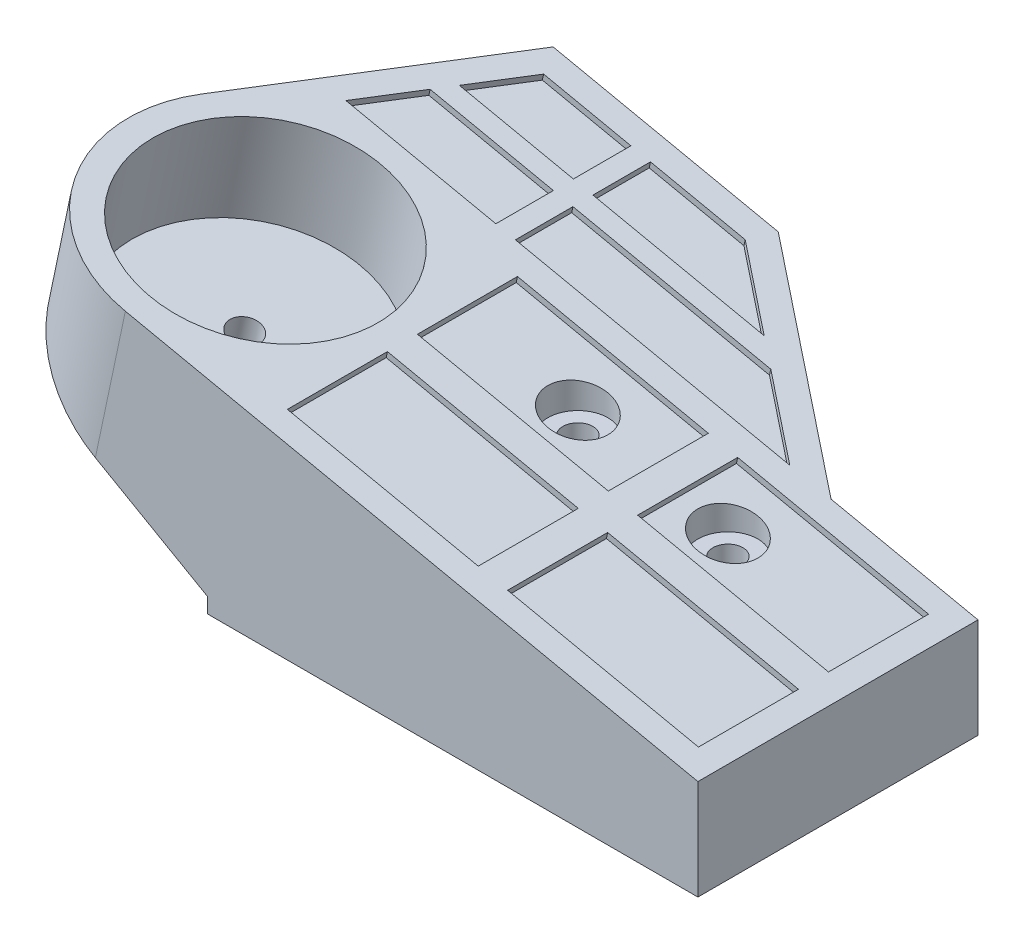
from build123d import *

# Parameters (mm, degrees)
BOSS_EXTRUDE1_DEPTH     = 28
BOSS_EXTRUDE2_DEPTH     = 10
CUT_EXTRUDE1_DEPTH      = 57.373228864
CUT_EXTRUDE1_DEPTH_BACK = 57.373228864
SKETCH3_R               = 11.5
CUT_EXTRUDE2_DEPTH      = 10
SKETCH4_R               = 1.5
CUT_EXTRUDE3_DEPTH      = 62.725197448
SKETCH5_W               = 19.5
SKETCH5_H               = 10
SKETCH5_RX              = 1.533173802
SKETCH5_RY              = 1.5
CUT_EXTRUDE4_DEPTH      = 0.6
CUT_EXTRUDE5_REACH      = 60.146
SKETCH6_R               = 3
CUT_EXTRUDE6_REACH      = 60.146
SKETCH7_R               = 3
CUT_EXTRUDE7_REACH      = 58.762
SKETCH8_R               = 1.5
CUT_EXTRUDE8_REACH      = 60.369
SKETCH9_R               = 3


with BuildPart() as part:
    # Sketch1 → Boss-Extrude1 (new body)
    with BuildSketch(Plane.XY):
        Polygon((0, 0), (49, 0), (49, 10), (-21.931026719, 25), (-24, 15.216373394), (0, 1.5), align=None)
    extrude(amount=BOSS_EXTRUDE1_DEPTH)

    # Sketch2 → Boss-Extrude2 (add)
    with BuildSketch(Plane(origin=(4.121724919, 19.490545356, 0), x_dir=(0.9783626605804883, -0.20689732811679465, 0), z_dir=(0.20689732811679465, 0.9783626605804883, 0))):
        Polygon((-13.893841917, 16), (-21.483308301, 0), (30.854721254, 0), (9.106158083, 16), align=None)
    extrude(amount=-BOSS_EXTRUDE2_DEPTH)

    # Sketch2<3> → Cut-Extrude1 (cut, two sides: drawn at the far end of the back side and taken through both)
    with BuildSketch(Plane(origin=(4.121724919, 19.490545356, 0), x_dir=(0.9783626605804883, -0.20689732811679465, 0), z_dir=(0.20689732811679465, 0.9783626605804883, 0)).offset(-CUT_EXTRUDE1_DEPTH_BACK)):
        with BuildLine():
            ThreePointArc((-12.628930853, -28), (-22.528425788, -23.899494938), (-26.628930853, -14.000000004))
            Line((-26.628930853, -14.000000004), (-26.628930853, -28))
            Line((-26.628930853, -28), (-12.628930853, -28))
        make_face()
        with BuildLine():
            Line((-25.278041493, -8), (-21.483308301, 0))
            Line((-21.483308301, 0), (-26.628930853, 0))
            Line((-26.628930853, 0), (-26.628930853, -14.000000004))
            ThreePointArc((-26.628930853, -14.000000004), (-26.287033741, -10.924902359), (-25.278041493, -8))
        make_face()
    extrude(amount=CUT_EXTRUDE1_DEPTH + CUT_EXTRUDE1_DEPTH_BACK, mode=Mode.SUBTRACT)

    # Sketch3 → Cut-Extrude2 (cut)
    with BuildSketch(Plane(origin=(4.121724919, 19.490545356, 0), x_dir=(0.9783626605804883, -0.20689732811679465, 0), z_dir=(0.20689732811679465, 0.9783626605804883, 0))):
        with Locations(Location((-12.628930853, -14, 0), (0, 0, 180))):
            Circle(SKETCH3_R)
    extrude(amount=-CUT_EXTRUDE2_DEPTH, mode=Mode.SUBTRACT)

    # Sketch4 → Cut-Extrude3 (cut, through all)
    with BuildSketch(Plane.XZ):
        with Locations(Location((17, 8, 0), (0, 0, 270))):
            Circle(SKETCH4_R)
        with Locations(Location((32, 8, 0), (0, 0, 270))):
            Circle(SKETCH4_R)
    extrude(amount=-CUT_EXTRUDE3_DEPTH, mode=Mode.SUBTRACT)

    # Sketch5 → Cut-Extrude4 (cut)
    # profile 1 of 10: a face of its own
    with BuildSketch(Plane(origin=(4.121724919, 19.490545356, 0), x_dir=(0.9783626605804883, -0.2068973281167947, 0), z_dir=(0.2068973281167947, 0.9783626605804883, 0))):
        Polygon((-18.716315349, 0), (-3.393841917, 0), (-3.393841917, 5.75), (-15.988850867, 5.75), align=None)
    # profile 2 of 10: a face of its own
    with BuildSketch(Plane(origin=(4.121724919, 19.490545356, 0), x_dir=(0.9783626605804883, -0.2068973281167947, 0), z_dir=(0.2068973281167947, 0.9783626605804883, 0))):
        Polygon((-15.040167569, 7.75), (-3.393841917, 7.75), (-3.393841917, 13.5), (-12.312703087, 13.5), align=None)
    # profile 3 of 10: a face of its own
    with BuildSketch(Plane(origin=(4.121724919, 19.490545356, 0), x_dir=(0.9783626605804883, -0.2068973281167947, 0), z_dir=(0.2068973281167947, 0.9783626605804883, 0))):
        Polygon((-1.393841917, 7.75), (16.101510968, 7.75), (8.285621079, 13.5), (-1.393841917, 13.5), align=None)
    # profile 4 of 10: a face of its own
    with BuildSketch(Plane(origin=(4.121724919, 19.490545356, 0), x_dir=(0.9783626605804883, -0.2068973281167947, 0), z_dir=(0.2068973281167947, 0.9783626605804883, 0))):
        Polygon((20.870933117, 0), (23.870933117, 0), (26.635971254, 0), (18.820081364, 5.75), (-1.393841917, 5.75), (-1.393841917, 0), (1.370933117, 0), align=None)
    # profile 5 of 10: a face of its own
    with BuildSketch(Plane(origin=(4.121724919, 19.490545356, 0), x_dir=(0.9783626605804883, -0.2068973281167947, 0), z_dir=(0.2068973281167947, 0.9783626605804883, 0))):
        with Locations((11.120933117, -7.5)):
            Rectangle(SKETCH5_W, SKETCH5_H)
        with BuildLine():
            add(Edge.make_bspline(
                [(14.696263114, -8), (14.696263114, -5.401923789), (12.396502412, -6.700961894), (10.096741709, -8), (12.396502412, -9.299038106), (14.696263114, -10.598076211), (14.696263114, -8)],
                knots=[0, 0, 0, 2.094395102, 2.094395102, 4.188790205, 4.188790205, 6.283185307, 6.283185307, 6.283185307], degree=2, weights=[1, 0.5, 1, 0.5, 1, 0.5, 1]))
        make_face(mode=Mode.SUBTRACT)
    # profile 6 of 10: a face of its own
    with BuildSketch(Plane(origin=(4.121724919, 19.490545356, 0), x_dir=(0.9783626605804883, -0.2068973281167947, 0), z_dir=(0.2068973281167947, 0.9783626605804883, 0))):
        with Locations((11.120933117, -20.5)):
            Rectangle(SKETCH5_W, SKETCH5_H)
    # profile 7 of 10: a face of its own
    with BuildSketch(Plane(origin=(4.121724919, 19.490545356, 0), x_dir=(0.9783626605804883, -0.2068973281167947, 0), z_dir=(0.2068973281167947, 0.9783626605804883, 0))):
        with Locations((33.620933117, -20.5)):
            Rectangle(SKETCH5_W, SKETCH5_H)
    # profile 8 of 10: a face of its own
    with BuildSketch(Plane(origin=(4.121724919, 19.490545356, 0), x_dir=(0.9783626605804883, -0.2068973281167947, 0), z_dir=(0.2068973281167947, 0.9783626605804883, 0))):
        with Locations((33.620933117, -7.5)):
            Rectangle(SKETCH5_W, SKETCH5_H)
        with BuildLine():
            add(Edge.make_bspline(
                [(30.028001134, -8), (30.028001134, -5.401923789), (27.728240431, -6.700961894), (25.428479728, -8), (27.728240431, -9.299038106), (30.028001134, -10.598076211), (30.028001134, -8)],
                knots=[0, 0, 0, 2.094395102, 2.094395102, 4.188790205, 4.188790205, 6.283185307, 6.283185307, 6.283185307], degree=2, weights=[1, 0.5, 1, 0.5, 1, 0.5, 1]))
        make_face(mode=Mode.SUBTRACT)
    # profile 9 of 10: a face of its own
    with BuildSketch(Plane(origin=(4.121724919, 19.490545356, 0), x_dir=(0.9783626605804883, -0.2068973281167947, 0), z_dir=(0.2068973281167947, 0.9783626605804883, 0))):
        with Locations((13.163089313, -8)):
            Ellipse(SKETCH5_RX, SKETCH5_RY)
    # profile 10 of 10: a face of its own
    with BuildSketch(Plane(origin=(4.121724919, 19.490545356, 0), x_dir=(0.9783626605804883, -0.2068973281167947, 0), z_dir=(0.2068973281167947, 0.9783626605804883, 0))):
        with Locations((28.494827332, -8)):
            Ellipse(SKETCH5_RX, SKETCH5_RY)
    extrude(amount=-CUT_EXTRUDE4_DEPTH, mode=Mode.SUBTRACT)

    # Cut-Extrude5: up to this plane
    cut_extrude5_end = Plane(origin=(3.997586522, 18.90352776, 0), z_dir=(0.2068973281167947, 0.9783626605804882, 0))
    # Sketch6 → Cut-Extrude5 (cut, up to the surface)
    with BuildSketch(Plane(origin=(0, 14, 0), x_dir=(-1, 0, 0), z_dir=(0, -1, 0)), mode=Mode.PRIVATE) as cut_extrude5_sk1:
        with Locations(Location((-17, -8, 0), (0, 0, 90))):
            Circle(SKETCH6_R)
    cut_extrude5_tool1 = split(extrude(cut_extrude5_sk1.sketch, amount=-CUT_EXTRUDE5_REACH, mode=Mode.PRIVATE), bisect_by=cut_extrude5_end, keep=Keep.BOTH, mode=Mode.PRIVATE)
    add(cut_extrude5_tool1.solids().sort_by_distance((17, 14, 8))[0], mode=Mode.SUBTRACT)

    # Cut-Extrude6: up to this plane
    cut_extrude6_end = Plane(origin=(3.997586522, 18.90352776, 0), z_dir=(0.2068973281167947, 0.9783626605804882, 0))
    # Sketch7 → Cut-Extrude6 (cut, up to the surface)
    with BuildSketch(Plane(origin=(0, 11, 0), x_dir=(-1, 0, 0), z_dir=(0, -1, 0)), mode=Mode.PRIVATE) as cut_extrude6_sk1:
        with Locations(Location((-32, -8, 0), (0, 0, 90))):
            Circle(SKETCH7_R)
    cut_extrude6_tool1 = split(extrude(cut_extrude6_sk1.sketch, amount=-CUT_EXTRUDE6_REACH, mode=Mode.PRIVATE), bisect_by=cut_extrude6_end, keep=Keep.BOTH, mode=Mode.PRIVATE)
    add(cut_extrude6_tool1.solids().sort_by_distance((32, 11, 8))[0], mode=Mode.SUBTRACT)

    # Cut-Extrude7: up to this plane
    cut_extrude7_end = Plane(origin=(-24, 15.216373394, 28), z_dir=(0.49619586981986724, 0.8682106073837761, 0))
    # Sketch8 → Cut-Extrude7 (cut, up to the surface)
    with BuildSketch(Plane(origin=(2.052751638, 9.70691875, 0), x_dir=(0.9783626605804883, -0.2068973281167947, 0), z_dir=(0.2068973281167947, 0.9783626605804883, 0)), mode=Mode.PRIVATE) as cut_extrude7_sk1:
        with Locations(Location((-12.628930853, -14, 0), (0, 0, 180))):
            Circle(SKETCH8_R)
    cut_extrude7_tool1 = split(extrude(cut_extrude7_sk1.sketch, amount=-CUT_EXTRUDE7_REACH, mode=Mode.PRIVATE), bisect_by=cut_extrude7_end, keep=Keep.BOTH, mode=Mode.PRIVATE)
    add(cut_extrude7_tool1.solids().sort_by_distance((-10.302923, 12.319811, 14))[0], mode=Mode.SUBTRACT)

    # Sketch9 → Cut-Extrude8 (cut, up to next)
    with BuildSketch(Plane(origin=(1.328610989, 6.282649438, 0), x_dir=(0.9783626605804883, -0.2068973281167947, 0), z_dir=(0.2068973281167947, 0.9783626605804883, 0)), mode=Mode.PRIVATE) as cut_extrude8_sk1:
        with Locations(Location((-12.628930853, -14, 0), (0, 0, 180))):
            Circle(SKETCH9_R)
    cut_extrude8_tool1 = extrude(cut_extrude8_sk1.sketch, amount=-CUT_EXTRUDE8_REACH, mode=Mode.PRIVATE) & part.part
    add(cut_extrude8_tool1.solids().sort_by_distance((-11.027063, 8.895541, 14))[0], mode=Mode.SUBTRACT)


solid = part.part
